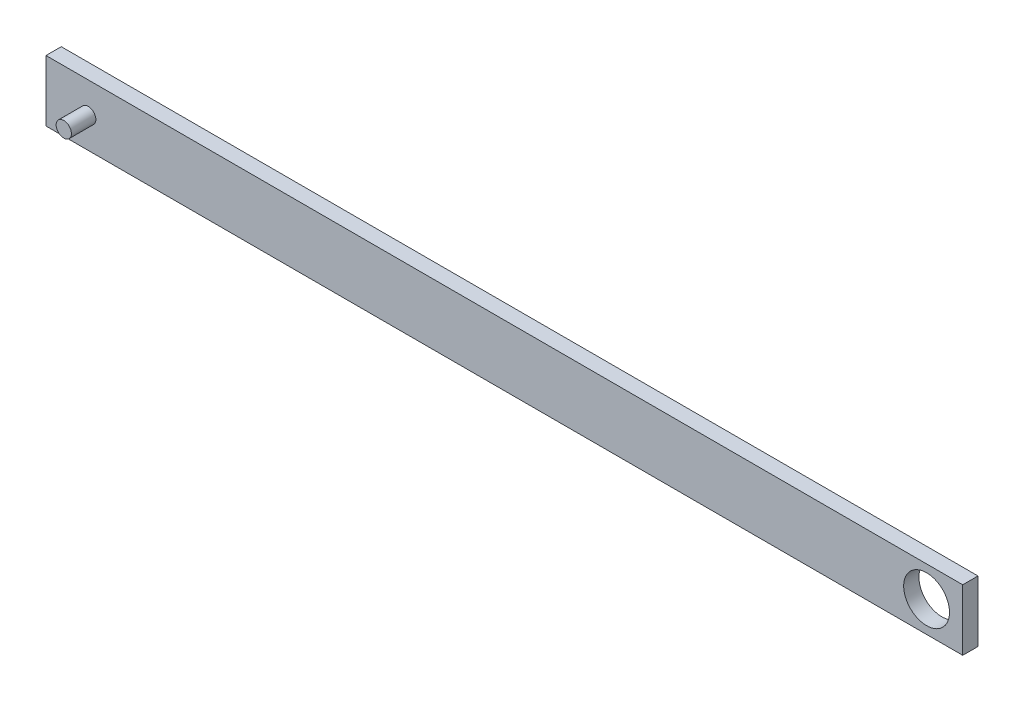
from build123d import *

# Parameters (mm, degrees)
SKETCH1_W           = 300
SKETCH1_H           = 20
BOSS_EXTRUDE1_DEPTH = 5
SKETCH2_R           = 7.5
CUT_EXTRUDE1_DEPTH  = 151.416089565
SKETCH3_R           = 2.5
BOSS_EXTRUDE2_DEPTH = 8


with BuildPart() as part:
    # Sketch1 → Boss-Extrude1 (new body)
    with BuildSketch(Plane.XY):
        Rectangle(SKETCH1_W, SKETCH1_H)
    extrude(amount=BOSS_EXTRUDE1_DEPTH)

    # Sketch2 → Cut-Extrude1 (cut, through all)
    with BuildSketch(Plane.XY.offset(5)):
        with Locations((138.172978114, 0)):
            Circle(SKETCH2_R)
    extrude(amount=-CUT_EXTRUDE1_DEPTH, mode=Mode.SUBTRACT)

    # Sketch3 → Boss-Extrude2 (add)
    with BuildSketch(Plane.XY.offset(5)):
        with Locations((-136.185092233, 0)):
            Circle(SKETCH3_R)
    extrude(amount=BOSS_EXTRUDE2_DEPTH)


solid = part.part
